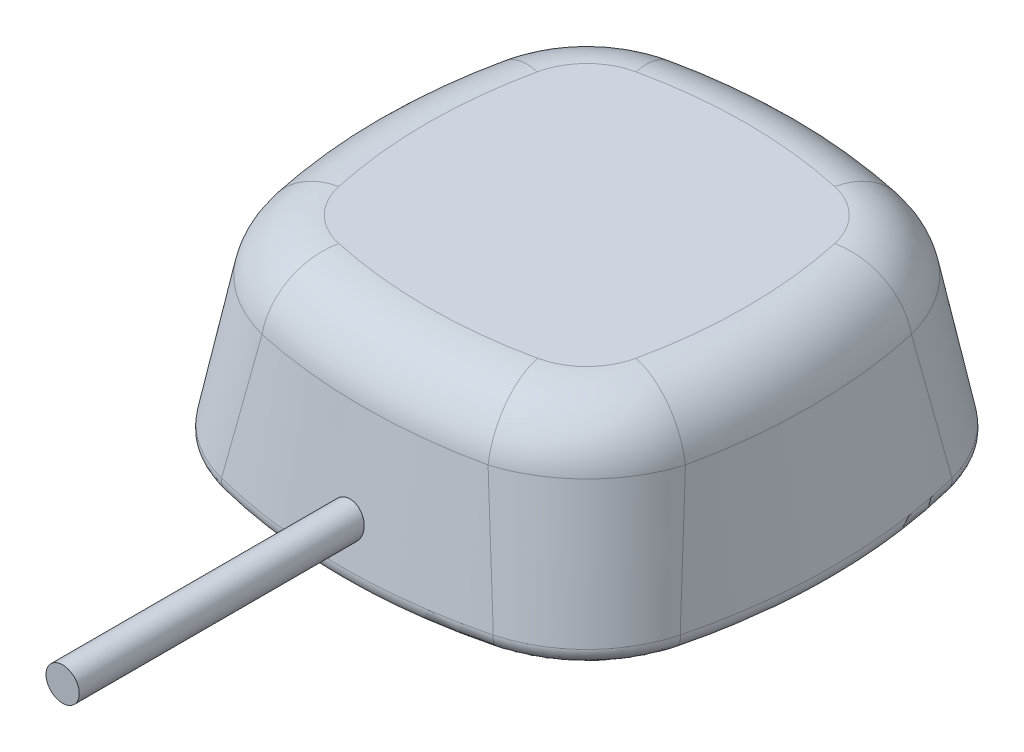
from build123d import *

# Parameters (mm, degrees)
BOSS_EXTRUDE1_DEPTH = 15
DRAFT1_ANGLE        = -10
FILLET1_R           = 10
FILLET2_R           = 5
FILLET3_R           = 1
SKETCH2_R           = 1.27
BOSS_EXTRUDE2_DEPTH = 40


with BuildPart() as part:
    # Sketch1 → Boss-Extrude1 (new body)
    with BuildSketch(Plane(origin=(0, 0, 0), x_dir=(1, 0, 0), z_dir=(0, 1, 0))):
        with BuildLine():
            ThreePointArc((-15.909902577, 15.909902577), (-19, 0), (-15.909902577, -15.909902577))
            ThreePointArc((-15.909902577, -15.909902577), (0, -19), (15.909902577, -15.909902577))
            ThreePointArc((15.909902577, -15.909902577), (19, 0), (15.909902577, 15.909902577))
            ThreePointArc((15.909902577, 15.909902577), (0, 19), (-15.909902577, 15.909902577))
        make_face()
    extrude(amount=BOSS_EXTRUDE1_DEPTH)

    # Draft1
    draft1_faces = [part.faces().sort_by_distance(p)[0] for p in [
        (0, 7.5, 19),
        (-19, 7.5, 0),
        (0, 7.5, -19),
        (19, 7.5, 0),
    ]]
    draft(draft1_faces, Plane(origin=(11.751247623, 0, 11.751247623), x_dir=(0, 0, -1), z_dir=(0, -1, 0)), DRAFT1_ANGLE)

    # Fillet1
    fillet1_edges = [part.edges().sort_by_distance(p)[0] for p in [
        (14.890825178, 7.500840423, -14.890825178),
        (14.890825178, 7.500840423, 14.890825178),
        (-14.890825178, 7.500840423, 14.890825178),
        (-14.890825178, 7.500840423, -14.890825178),
    ]]
    fillet(fillet1_edges, radius=FILLET1_R)

    # Fillet2
    fillet2_edges = [part.edges().sort_by_distance(p)[0] for p in [
        (-12.885422798, 15, 12.8854228),
        (-16.355095289, 15, 0),
        (-12.8854228, 15, -12.885422798),
        (0, 15, -16.355095289),
        (12.885422798, 15, -12.8854228),
        (16.355095289, 15, 0),
        (12.885422798, 15, 12.8854228),
        (0, 15, 16.355095289),
    ]]
    fillet(fillet2_edges, radius=FILLET2_R)

    # Fillet3
    fillet3_edges = [part.edges().sort_by_distance(p)[0] for p in [
        (-15.091189529, 0, 15.091189529),
        (-19, 0, 0),
        (-15.091189529, 0, -15.091189529),
        (0, 0, -19),
        (15.091189529, 0, -15.091189529),
        (19, 0, 0),
        (15.091189529, 0, 15.091189529),
        (0, 0, 19),
    ]]
    fillet(fillet3_edges, radius=FILLET3_R)

    # Sketch2 → Boss-Extrude2 (add)
    with BuildSketch(Plane.XY):
        with Locations(Location((0, 4, 0), (0, 0, 225.124613525))):
            Circle(SKETCH2_R)
    extrude(amount=BOSS_EXTRUDE2_DEPTH)


solid = part.part
